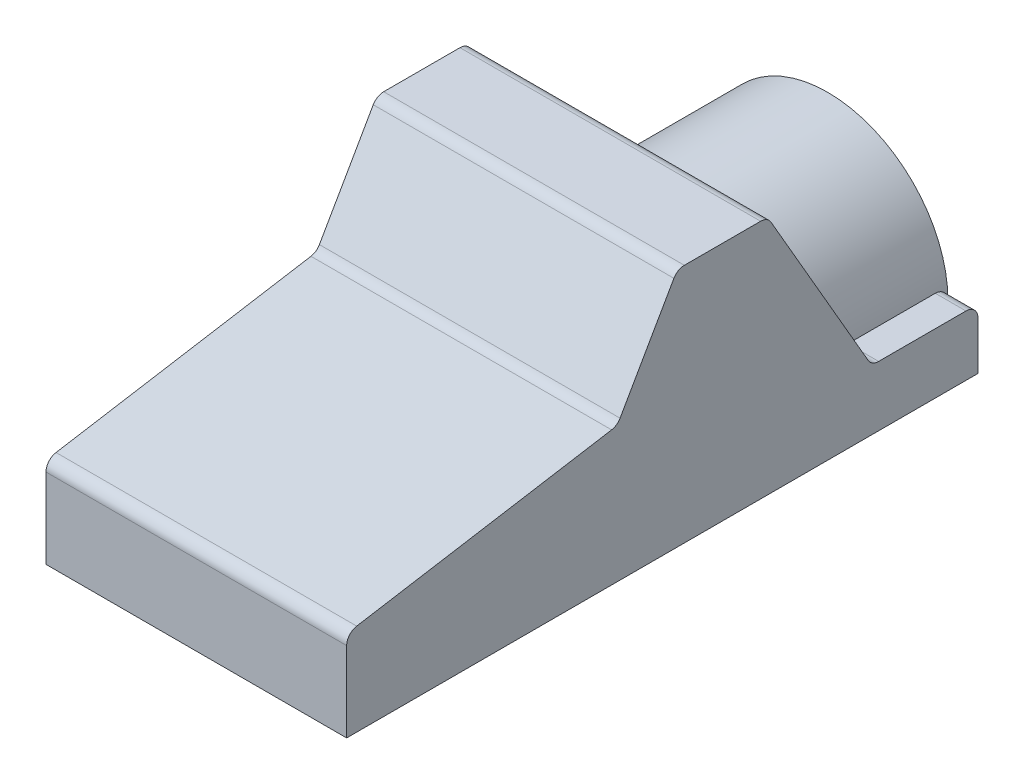
from build123d import *

# Parameters (mm, degrees)
BOSS_EXTRUDE1_DEPTH = 31.75
BOSS_EXTRUDE2_REACH = 148.188
CUT_EXTRUDE1_DEPTH  = 53.975


with BuildPart() as part:
    # Sketch1 → Boss-Extrude1 (new, symmetric)
    with BuildSketch(Plane(origin=(0, 0, 0), x_dir=(0, 0, -1), z_dir=(1, 0, 0))):
        with BuildLine():
            Line((0, 0), (-133.35, 0))
            Line((-133.35, 0), (-133.35, 16.898297196))
            ThreePointArc((-133.35, 16.898297196), (-132.748070755, 18.540089432), (-131.227573428, 19.403737762))
            Line((-131.227573428, 19.403737762), (-77.389477645, 28.376753726))
            ThreePointArc((-77.389477645, 28.376753726), (-76.355301792, 28.797962054), (-75.601713492, 29.622001389))
            Line((-75.601713492, 29.622001389), (-64.231318341, 49.520192903))
            ThreePointArc((-64.231318341, 49.520192903), (-63.300874878, 50.456871637), (-62.02598076, 50.8))
            Line((-62.02598076, 50.8), (-45.916469684, 50.8))
            ThreePointArc((-45.916469684, 50.8), (-44.646469684, 50.459704526), (-43.716765158, 49.53))
            Line((-43.716765158, 49.53), (-23.186189586, 13.97))
            ThreePointArc((-23.186189586, 13.97), (-22.25648506, 13.040295474), (-20.98648506, 12.7))
            Line((-20.98648506, 12.7), (-2.54, 12.7))
            ThreePointArc((-2.54, 12.7), (-0.743948776, 11.956051224), (0, 10.16))
            Line((0, 10.16), (0, 0))
        make_face()
    extrude(amount=BOSS_EXTRUDE1_DEPTH, both=True)

    # Sketch2 → Boss-Extrude2 (add, up to next)
    with BuildSketch(Plane(origin=(0, 0, 0), x_dir=(-1, 0, 0), z_dir=(0, 0, -1)), mode=Mode.PRIVATE) as boss_extrude2_sk1:
        with BuildLine():
            Line((-31.75, 0), (-12.7, 0))
            Line((-12.7, 0), (12.7, 0))
            Line((12.7, 0), (31.75, 0))
            Line((31.75, 0), (31.75, 10.16))
            Line((31.75, 10.16), (25.4, 10.16))
            ThreePointArc((25.4, 10.16), (0, 35.56), (-25.4, 10.16))
            Line((-25.4, 10.16), (-31.75, 10.16))
            Line((-31.75, 10.16), (-31.75, 0))
        make_face()
    boss_extrude2_tool1 = extrude(boss_extrude2_sk1.sketch, amount=-BOSS_EXTRUDE2_REACH, mode=Mode.PRIVATE) - part.part
    add(boss_extrude2_tool1.solids().sort_by_distance((0, 14.770763, 0))[0])

    # Sketch3 → Cut-Extrude1 (cut)
    with BuildSketch(Plane(origin=(0, 0, 0), x_dir=(-1, 0, 0), z_dir=(0, 0, -1))):
        with BuildLine():
            Line((-12.7, 0), (12.7, 0))
            Line((12.7, 0), (12.7, 12.7))
            ThreePointArc((12.7, 12.7), (0, 25.4), (-12.7, 12.7))
            Line((-12.7, 12.7), (-12.7, 0))
        make_face()
    extrude(amount=-CUT_EXTRUDE1_DEPTH, mode=Mode.SUBTRACT)


solid = part.part
